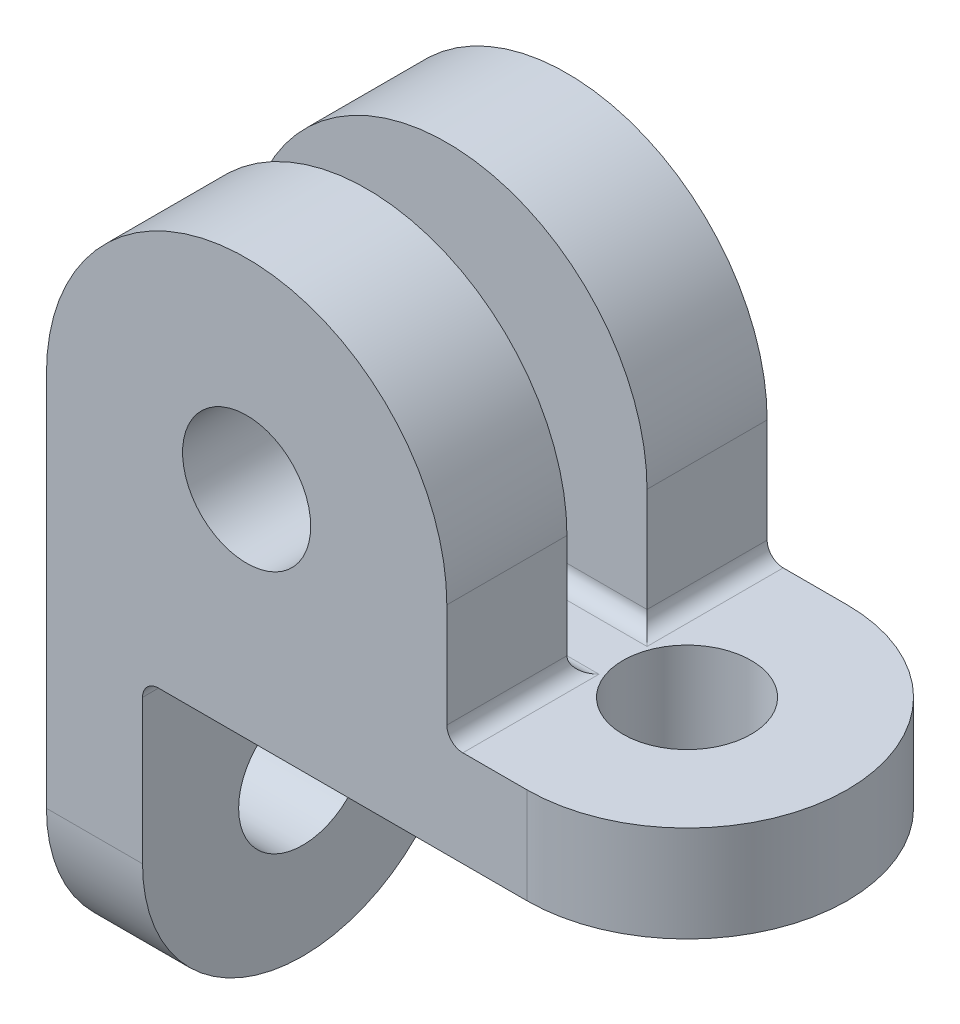
from build123d import *

# Parameters (mm, degrees)
SKETCH1_W                   = 80
SKETCH1_H                   = 40
BOSS_EXTRUDE1_DEPTH         = 12
FILLET1_RADIUS              = 20
FILLET1_LENGTH              = 12
SKETCH2_W                   = 50
SKETCH2_H                   = 15
BOSS_EXTRUDE2_DEPTH         = 40
FILLET3_RADIUS              = 25
FILLET3_LENGTH              = 15
SKETCH4_R                   = 8
CUT_EXTRUDE2_DEPTH          = 40
FILLET3_OF_MIRROR7_2_RADIUS = 25
FILLET3_OF_MIRROR7_2_LENGTH = 15
SKETCH5_R                   = 8
CUT_EXTRUDE4_DEPTH          = 40
SKETCH7_W                   = 12
SKETCH7_H                   = 40
BOSS_EXTRUDE3_DEPTH         = 40
FILLET4_RADIUS              = 20
FILLET4_LENGTH              = 12
SKETCH8_R                   = 8
CUT_EXTRUDE5_DEPTH          = 40
FILLET6_R                   = 2
FILLET7_R                   = 2
FILLET8_R                   = 2
FILLET9_R                   = 2
FILLET10_R                  = 2


with BuildPart() as part:
    # Sketch1 → Boss-Extrude1 (new body)
    with BuildSketch(Plane(origin=(0, 0, 0), x_dir=(1, 0, 0), z_dir=(0, 1, 0))):
        Rectangle(SKETCH1_W, SKETCH1_H)
    extrude(amount=BOSS_EXTRUDE1_DEPTH)

    # Fillet1: full round fillet: the end face becomes a half cylinder, R = half its width
    fillet1_face = Plane((40, 6, 0), x_dir=(0, -1, 0), z_dir=(1, 0, 0))  # on the end face: x along it, z out of the body
    fillet1_slab = fillet1_face.offset(-FILLET1_RADIUS / 2) * Box(FILLET1_LENGTH, 2 * FILLET1_RADIUS, FILLET1_RADIUS, mode=Mode.PRIVATE)  # the body's end, R deep
    fillet1_round = Plane((20, 6, 0), x_dir=(1, 0, 0), z_dir=(0, -1, 0)) * Cylinder(FILLET1_RADIUS, FILLET1_LENGTH, mode=Mode.PRIVATE)  # its axis R under the face
    add(fillet1_slab - fillet1_round, mode=Mode.SUBTRACT)

    # Sketch2 → Boss-Extrude2 (add)
    with BuildSketch(Plane(origin=(0, 12, 0), x_dir=(1, 0, 0), z_dir=(0, 1, 0))):
        with Locations((-15, -12.5)):
            Rectangle(SKETCH2_W, SKETCH2_H)
    boss_extrude2 = extrude(amount=BOSS_EXTRUDE2_DEPTH)

    # Fillet3: full round fillet: the end face becomes a half cylinder, R = half its width
    fillet3_face = Plane((-15, 52, 12.5), x_dir=(0, 0, 1), z_dir=(0, 1, 0))  # on the end face: x along it, z out of the body
    fillet3_slab = fillet3_face.offset(-FILLET3_RADIUS / 2) * Box(FILLET3_LENGTH, 2 * FILLET3_RADIUS, FILLET3_RADIUS, mode=Mode.PRIVATE)  # the body's end, R deep
    fillet3_round = Plane((-15, 27, 12.5), x_dir=(0, 1, 0), z_dir=(0, 0, 1)) * Cylinder(FILLET3_RADIUS, FILLET3_LENGTH, mode=Mode.PRIVATE)  # its axis R under the face
    add(fillet3_slab - fillet3_round, mode=Mode.SUBTRACT)

    # Sketch4 → Cut-Extrude2 (cut)
    with BuildSketch(Plane.XY.offset(20)):
        with Locations((-15, 27)):
            Circle(SKETCH4_R)
    cut_extrude2 = extrude(amount=-CUT_EXTRUDE2_DEPTH, mode=Mode.SUBTRACT)

    # Mirror7: Boss-Extrude2, Cut-Extrude2 across plane
    add(boss_extrude2.mirror(Plane.XY))
    add(cut_extrude2.mirror(Plane.XY), mode=Mode.SUBTRACT)

    # Fillet3 of Mirror7 2: full round fillet: the end face becomes a half cylinder, R = half its width
    fillet3_of_mirror7_2_face = Plane((-15, 52, -12.5), x_dir=(0, 0, -1), z_dir=(0, 1, 0))  # on the end face: x along it, z out of the body
    fillet3_of_mirror7_2_slab = fillet3_of_mirror7_2_face.offset(-FILLET3_OF_MIRROR7_2_RADIUS / 2) * Box(FILLET3_OF_MIRROR7_2_LENGTH, 2 * FILLET3_OF_MIRROR7_2_RADIUS, FILLET3_OF_MIRROR7_2_RADIUS, mode=Mode.PRIVATE)  # the body's end, R deep
    fillet3_of_mirror7_2_round = Plane((-15, 27, -12.5), x_dir=(0, 1, 0), z_dir=(0, 0, -1)) * Cylinder(FILLET3_OF_MIRROR7_2_RADIUS, FILLET3_OF_MIRROR7_2_LENGTH, mode=Mode.PRIVATE)  # its axis R under the face
    add(fillet3_of_mirror7_2_slab - fillet3_of_mirror7_2_round, mode=Mode.SUBTRACT)

    # Sketch5 → Cut-Extrude4 (cut)
    with BuildSketch(Plane(origin=(0, 12, 0), x_dir=(1, 0, 0), z_dir=(0, 1, 0))):
        with Locations(Location((20, 0, 0), (0, 0, 270))):
            Circle(SKETCH5_R)
    extrude(amount=-CUT_EXTRUDE4_DEPTH, mode=Mode.SUBTRACT)

    # Sketch7 → Boss-Extrude3 (add)
    with BuildSketch(Plane(origin=(0, 0, 0), x_dir=(-1, 0, 0), z_dir=(0, -1, 0))):
        with Locations((34, 0)):
            Rectangle(SKETCH7_W, SKETCH7_H)
    extrude(amount=BOSS_EXTRUDE3_DEPTH)

    # Fillet4: full round fillet: the end face becomes a half cylinder, R = half its width
    fillet4_face = Plane((-34, -40, 0), x_dir=(1, 0, 0), z_dir=(0, -1, 0))  # on the end face: x along it, z out of the body
    fillet4_slab = fillet4_face.offset(-FILLET4_RADIUS / 2) * Box(FILLET4_LENGTH, 2 * FILLET4_RADIUS, FILLET4_RADIUS, mode=Mode.PRIVATE)  # the body's end, R deep
    fillet4_round = Plane((-34, -20, 0), x_dir=(0, -1, 0), z_dir=(1, 0, 0)) * Cylinder(FILLET4_RADIUS, FILLET4_LENGTH, mode=Mode.PRIVATE)  # its axis R under the face
    add(fillet4_slab - fillet4_round, mode=Mode.SUBTRACT)

    # Sketch8 → Cut-Extrude5 (cut)
    with BuildSketch(Plane.ZY.offset(40)):
        with Locations((0, -20)):
            Circle(SKETCH8_R)
    extrude(amount=-CUT_EXTRUDE5_DEPTH, mode=Mode.SUBTRACT)

    # Fillet6
    fillet6_edges = [part.edges().sort_by_distance(p)[0] for p in [
        (10, 12, 12.5),
    ]]
    fillet(fillet6_edges, radius=FILLET6_R)

    # Fillet7
    fillet7_edges = [part.edges().sort_by_distance(p)[0] for p in [
        (-14, 12, 5),
    ]]
    fillet(fillet7_edges, radius=FILLET7_R)

    # Fillet8
    fillet8_edges = [part.edges().sort_by_distance(p)[0] for p in [
        (-15, 12, -5),
    ]]
    fillet(fillet8_edges, radius=FILLET8_R)

    # Fillet9
    fillet9_edges = [part.edges().sort_by_distance(p)[0] for p in [
        (10, 12, -11.5),
    ]]
    fillet(fillet9_edges, radius=FILLET9_R)

    # Fillet10
    fillet10_edges = [part.edges().sort_by_distance(p)[0] for p in [
        (-28, 0, 0),
    ]]
    fillet(fillet10_edges, radius=FILLET10_R)


solid = part.part
